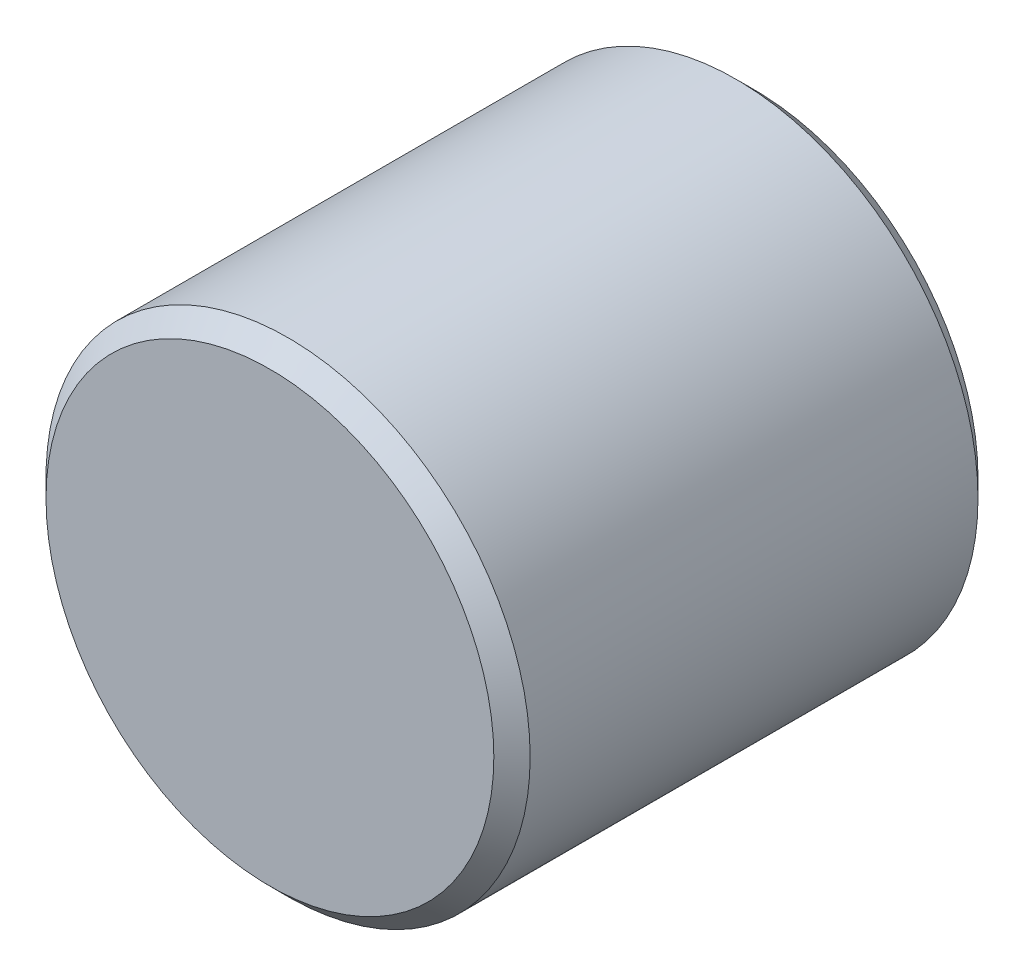
from build123d import *

# Parameters (mm, degrees)
SKETCH_1_R      = 4
EXTRUDE_1_DEPTH = 8
CHAMFER_1_SIZE  = 0.3


with BuildPart() as part:
    # Эскиз1 → Бобышка-Вытянуть1 (new body)
    with BuildSketch(Plane.XY):
        Circle(SKETCH_1_R)
    extrude(amount=EXTRUDE_1_DEPTH)

    # Фаска1
    chamfer_1_edges = [part.edges().sort_by_distance(p)[0] for p in [
        (-4, 0, 0),
        (-4, 0, 8),
    ]]
    chamfer(chamfer_1_edges, length=CHAMFER_1_SIZE)


solid = part.part
